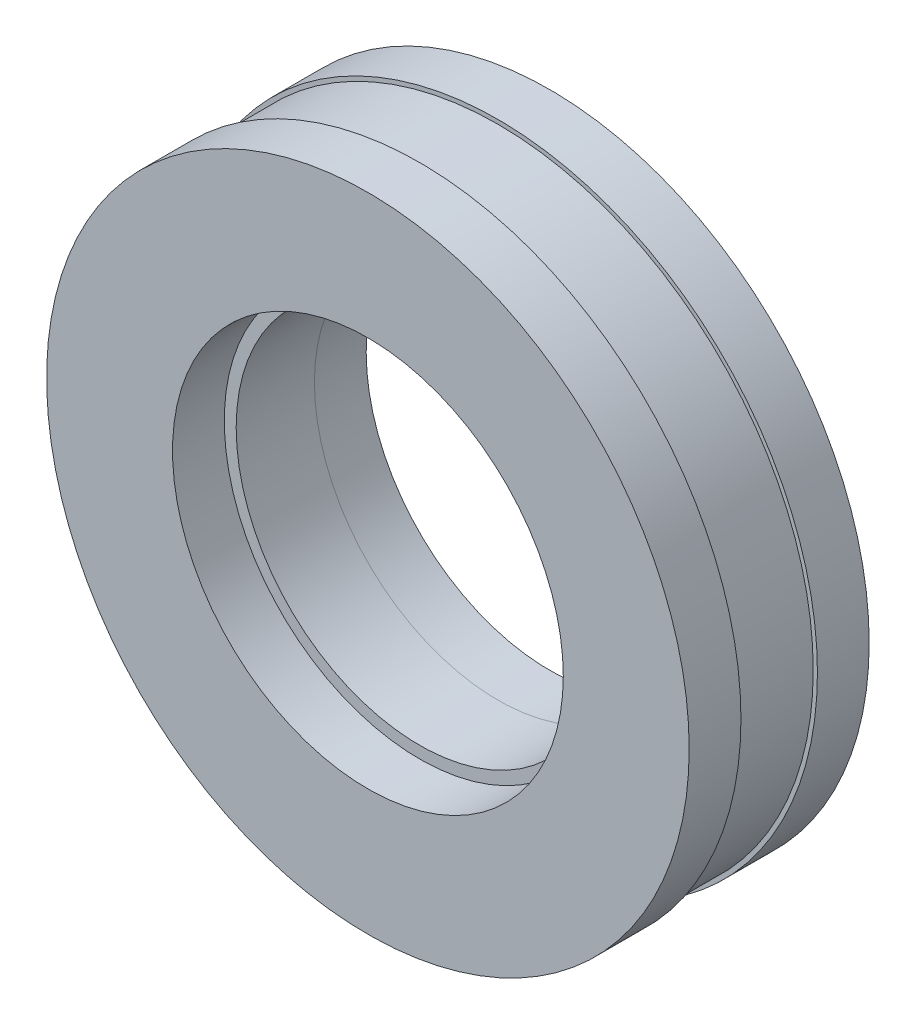
from build123d import *

# Parameters (mm, degrees)
SKETCH1_R           = 17.399
SKETCH1_R_2         = 10
BOSS_EXTRUDE1_DEPTH = 2.8194
SKETCH3_R           = 17.1704
SKETCH3_R_2         = 9.9949
BOSS_EXTRUDE2_DEPTH = 4.2672
SKETCH4_R           = 17.5006
SKETCH4_R_2         = 10.6426
BOSS_EXTRUDE3_DEPTH = 2.8194


with BuildPart() as part:
    # Sketch1 → Boss-Extrude1 (new body)
    with BuildSketch(Plane.XY):
        Circle(SKETCH1_R)
        Circle(SKETCH1_R_2, mode=Mode.SUBTRACT)
    extrude(amount=BOSS_EXTRUDE1_DEPTH)

    # Sketch3 → Boss-Extrude2 (add)
    with BuildSketch(Plane.XY.offset(2.8194)):
        Circle(SKETCH3_R)
        Circle(SKETCH3_R_2, mode=Mode.SUBTRACT)
    extrude(amount=BOSS_EXTRUDE2_DEPTH)

    # Sketch4 → Boss-Extrude3 (add)
    with BuildSketch(Plane.XY.offset(7.0866)):
        Circle(SKETCH4_R)
        Circle(SKETCH4_R_2, mode=Mode.SUBTRACT)
    extrude(amount=BOSS_EXTRUDE3_DEPTH)


solid = part.part
